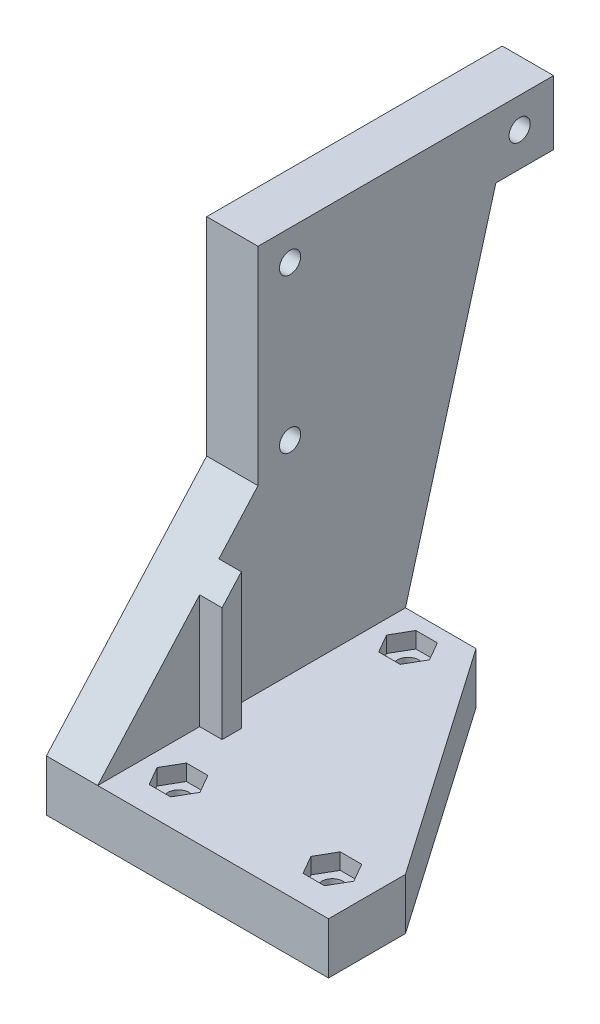
from build123d import *

# Parameters (mm, degrees)
SKETCH1_R           = 1.65
BOSS_EXTRUDE1_DEPTH = 8
SKETCH3_R           = 1.65
BOSS_EXTRUDE2_DEPTH = 8
CUT_EXTRUDE1_DEPTH  = 2.5
BOSS_EXTRUDE3_DEPTH = 3.5


with BuildPart() as part:
    # Sketch1 → Boss-Extrude1 (new body)
    with BuildSketch(Plane(origin=(0, 0, 0), x_dir=(1, 0, 0), z_dir=(0, 1, 0))):
        Polygon((-30.201635745, 21.458760302), (-19.201635745, 21.458760302), (5.798364255, -14.541239698), (5.798364255, -26.541239698), (-30.201635745, -26.541239698), align=None)
        with Locations((-24.651635745, 16.308760302)):
            Circle(SKETCH1_R, mode=Mode.SUBTRACT)
        with Locations((-24.651635745, -19.491239698)):
            Circle(SKETCH1_R, mode=Mode.SUBTRACT)
        with Locations((-0.651635745, -19.491239698)):
            Circle(SKETCH1_R, mode=Mode.SUBTRACT)
    extrude(amount=BOSS_EXTRUDE1_DEPTH)

    # Sketch3 → Boss-Extrude2 (add)
    with BuildSketch(Plane.ZY.offset(30.201635745)):
        Polygon((-44.558757353, 58.334529743), (-35.558757353, 58.334529743), (-21.458760302, 8), (-21.458760302, 0), (26.541239698, 0), (26.541239698, 8), (1.541239698, 36), (1.541239698, 68.334529743), (-44.558757353, 68.334529743), align=None)
        with Locations((-3.458760302, 39.65)):
            Circle(SKETCH3_R, mode=Mode.SUBTRACT)
        with Locations((-3.458760302, 63.65)):
            Circle(SKETCH3_R, mode=Mode.SUBTRACT)
        with Locations((-39.258757353, 63.664529743)):
            Circle(SKETCH3_R, mode=Mode.SUBTRACT)
    extrude(amount=BOSS_EXTRUDE2_DEPTH)

    # Sketch4 → Cut-Extrude1 (cut)
    with BuildSketch(Plane(origin=(0, 8, 0), x_dir=(1, 0, 0), z_dir=(0, 1, 0))):
        Polygon((-26.326635745, 13.407575199), (-22.976635745, 13.407575199), (-21.301635745, 16.308760302), (-22.976635745, 19.209945405), (-26.326635745, 19.209945405), (-28.001635745, 16.308760302), align=None)
        Polygon((-22.976635745, -16.590054595), (-26.326635745, -16.590054595), (-28.001635745, -19.491239698), (-26.326635745, -22.392424801), (-22.976635745, -22.392424801), (-21.301635745, -19.491239698), align=None)
        Polygon((1.023364255, -16.590054595), (-2.326635745, -16.590054595), (-4.001635745, -19.491239698), (-2.326635745, -22.392424801), (1.023364255, -22.392424801), (2.698364255, -19.491239698), align=None)
    extrude(amount=-CUT_EXTRUDE1_DEPTH, mode=Mode.SUBTRACT)

    # Sketch5 → Boss-Extrude3 (add)
    with BuildSketch(Plane(origin=(-30.201635745, 0, 0), x_dir=(0, 0, -1), z_dir=(1, 0, 0))):
        Polygon((-10.641239698, 8), (-7.641239698, 8), (-7.641239698, 29.168), (-10.641239698, 25.808), align=None)
    extrude(amount=BOSS_EXTRUDE3_DEPTH)


solid = part.part
